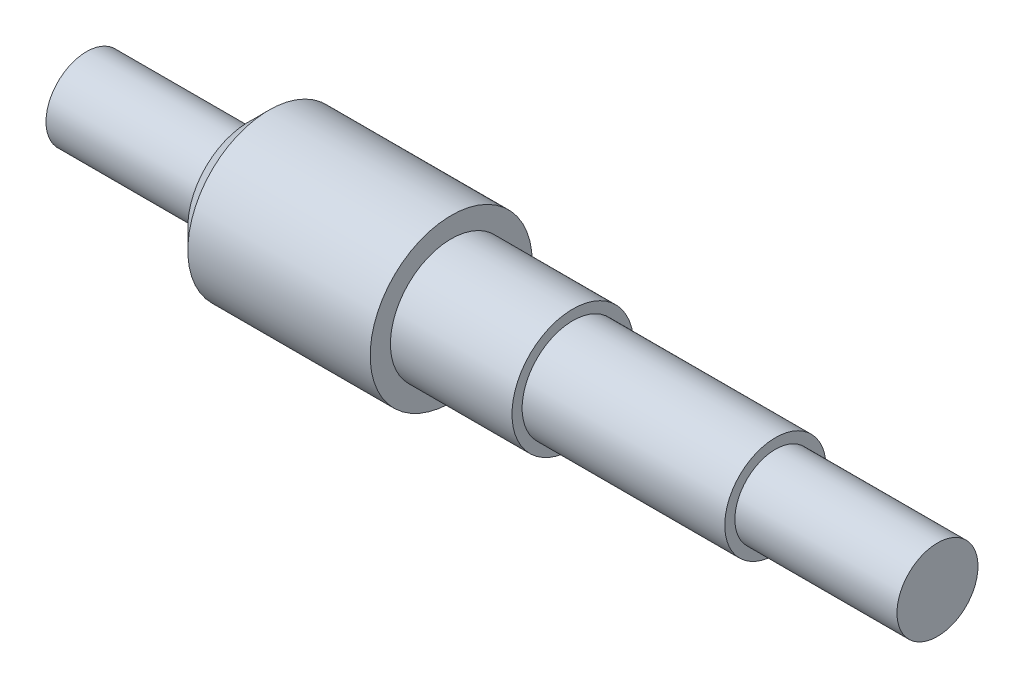
from build123d import *

# Parameters (mm, degrees)
SKETCH_1_R          = 4
EXTRUDE_1_DEPTH     = 10
SKETCH_2_R          = 2
EXTRUDE_2_DEPTH     = 8
SKETCH_3_R          = 3
EXTRUDE_3_DEPTH     = 16
EXTRUDE_START       = 8
SKETCH_4_R          = 2
EXTRUDE_4_DEPTH     = 8
CHAMFER_1_SIZE      = 1
CUT_EXTRUDE_START   = -10
SKETCH_5_R          = 3
SKETCH_5_R_2        = 2.5
CUT_EXTRUDE_1_DEPTH = 10


with BuildPart() as part:
    # 草图1 → 凸台-拉伸1 (new body)
    with BuildSketch(Plane(origin=(0, 0, 0), x_dir=(0, 0, -1), z_dir=(1, 0, 0))):
        Circle(SKETCH_1_R)
    extrude(amount=EXTRUDE_1_DEPTH)

    # 草图2 → 凸台-拉伸2 (add)
    with BuildSketch(Plane.ZY):
        with Locations(Location((0, 0, 0), (0, 0, 180))):
            Circle(SKETCH_2_R)
    extrude(amount=EXTRUDE_2_DEPTH)

    # 草图3 → 凸台-拉伸3 (add)
    with BuildSketch(Plane(origin=(10, 0, 0), x_dir=(0, 0, -1), z_dir=(1, 0, 0))):
        Circle(SKETCH_3_R)
    extrude(amount=EXTRUDE_3_DEPTH)

    # 草图4 → 凸台-拉伸4 (add)
    with BuildSketch(Plane(origin=(26, 0, 0), x_dir=(0, 0, -1), z_dir=(1, 0, 0)).offset(EXTRUDE_START)):
        Circle(SKETCH_4_R)
    extrude(amount=-EXTRUDE_4_DEPTH)

    # 倒角1
    chamfer_1_edges = [part.edges().sort_by_distance(p)[0] for p in [
        (0, 0, 4),
    ]]
    chamfer(chamfer_1_edges, length=CHAMFER_1_SIZE)

    # 草图5 → 切除-拉伸1 (cut)
    with BuildSketch(Plane(origin=(26, 0, 0), x_dir=(0, 0, -1), z_dir=(1, 0, 0)).offset(CUT_EXTRUDE_START)):
        Circle(SKETCH_5_R)
        Circle(SKETCH_5_R_2, mode=Mode.SUBTRACT)
    extrude(amount=CUT_EXTRUDE_1_DEPTH, mode=Mode.SUBTRACT)


solid = part.part
